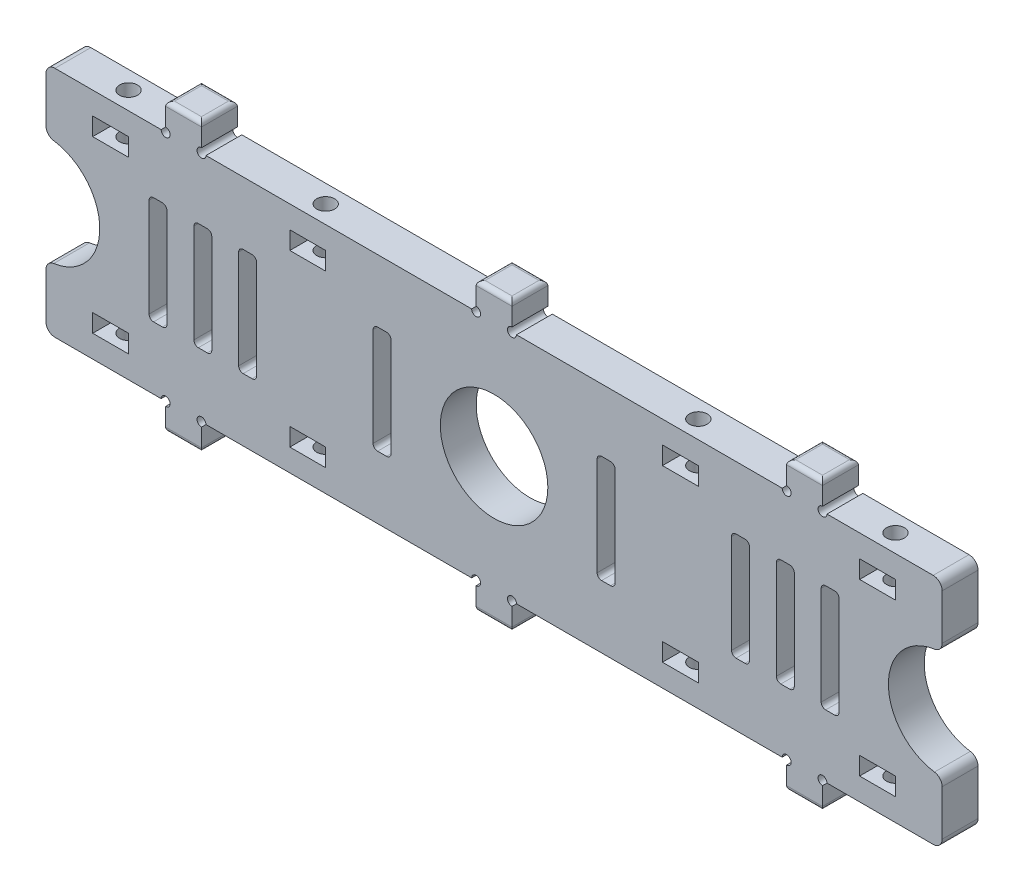
from build123d import *

# Parameters (mm, degrees)
SKETCH1_W           = 4
SKETCH1_H           = 2
BOSS_EXTRUDE3_DEPTH = 4
FILLET1_R           = 0.5
FILLET2_R           = 1
FILLET3_R           = 0.5
SKETCH3_R           = 1
CUT_EXTRUDE1_DEPTH  = 10


with BuildPart() as part:
    # Sketch1 → Boss-Extrude3 (new body)
    with BuildSketch(Plane.XY):
        with BuildLine():
            ThreePointArc((2.636402901, -4.272408368), (3.489956292, -3.918854978), (3.136402901, -4.772408368))
            Line((3.136402901, -4.772408368), (3.136402901, -7.272408368))
            Line((3.136402901, -7.272408368), (7.136402901, -7.272408368))
            Line((7.136402901, -7.272408368), (7.136402901, -4.772408368))
            ThreePointArc((7.136402901, -4.772408368), (6.782849511, -3.918854978), (7.636402901, -4.272408368))
            Line((7.636402901, -4.272408368), (37.286402901, -4.272408368))
            ThreePointArc((37.286402901, -4.272408368), (38.139956292, -3.918854978), (37.786402901, -4.772408368))
            Line((37.786402901, -4.772408368), (37.786402901, -7.272408368))
            Line((37.786402901, -7.272408368), (39.786402901, -7.272408368))
            Line((39.786402901, -7.272408368), (39.786402901, 2.727591632))
            ThreePointArc((39.786402901, 2.727591632), (35.543762214, 4.484950945), (33.786402901, 8.727591632))
            Line((33.786402901, 8.727591632), (28.286402901, 8.727591632))
            Line((28.286402901, 8.727591632), (28.286402901, 2.727591632))
            Line((28.286402901, 2.727591632), (26.286402901, 2.727591632))
            Line((26.286402901, 2.727591632), (26.286402901, 8.727591632))
            Line((26.286402901, 8.727591632), (13.286402901, 8.727591632))
            Line((13.286402901, 8.727591632), (13.286402901, 2.727591632))
            Line((13.286402901, 2.727591632), (11.286402901, 2.727591632))
            Line((11.286402901, 2.727591632), (11.286402901, 8.727591632))
            Line((11.286402901, 8.727591632), (8.286402901, 8.727591632))
            Line((8.286402901, 8.727591632), (8.286402901, 2.727591632))
            Line((8.286402901, 2.727591632), (6.286402901, 2.727591632))
            Line((6.286402901, 2.727591632), (6.286402901, 8.727591632))
            Line((6.286402901, 8.727591632), (3.286402901, 8.727591632))
            Line((3.286402901, 8.727591632), (3.286402901, 2.727591632))
            Line((3.286402901, 2.727591632), (1.286402901, 2.727591632))
            Line((1.286402901, 2.727591632), (1.286402901, 8.727591632))
            Line((1.286402901, 8.727591632), (-4.213597099, 8.727591632))
            ThreePointArc((-4.213597099, 8.727591632), (-5.970956412, 4.484950945), (-10.213597099, 2.727591632))
            Line((-10.213597099, 2.727591632), (-10.213597099, -4.272408368))
            Line((-10.213597099, -4.272408368), (2.636402901, -4.272408368))
        make_face()
        with Locations((-3.003597099, -0.772408368)):
            Rectangle(SKETCH1_W, SKETCH1_H, mode=Mode.SUBTRACT)
        with Locations((18.996402901, -0.772408368)):
            Rectangle(SKETCH1_W, SKETCH1_H, mode=Mode.SUBTRACT)
    extrude(amount=BOSS_EXTRUDE3_DEPTH)

    # Fillet1
    fillet1_edges = [part.edges().sort_by_distance(p)[0] for p in [
        (1.286402901, 2.727591632, 2),
        (3.286402901, 2.727591632, 2),
        (6.286402901, 2.727591632, 2),
        (8.286402901, 2.727591632, 2),
        (11.286402901, 2.727591632, 2),
        (13.286402901, 2.727591632, 2),
        (26.286402901, 2.727591632, 2),
        (28.286402901, 2.727591632, 2),
    ]]
    fillet(fillet1_edges, radius=FILLET1_R)

    # Fillet2
    fillet2_edges = [part.edges().sort_by_distance(p)[0] for p in [
        (-10.213597099, -4.272408368, 2),
        (-10.213597099, 2.727591632, 2),
    ]]
    fillet(fillet2_edges, radius=FILLET2_R)

    # Fillet3
    fillet3_edges = [part.edges().sort_by_distance(p)[0] for p in [
        (5.136402901, -7.272408368, 4),
        (38.786402901, -7.272408368, 4),
        (38.786402901, -7.272408368, 0),
        (5.136402901, -7.272408368, 0),
        (37.786402901, -7.272408368, 2),
        (7.136402901, -7.272408368, 2),
        (3.136402901, -7.272408368, 2),
    ]]
    fillet(fillet3_edges, radius=FILLET3_R)

    # Sketch3 → Cut-Extrude1 (cut)
    with BuildSketch(Plane.XZ.offset(4.272408368)):
        with Locations((18.996402901, 2)):
            Circle(SKETCH3_R)
        with Locations((-3.003597099, 2)):
            Circle(SKETCH3_R)
    extrude(amount=-CUT_EXTRUDE1_DEPTH, mode=Mode.SUBTRACT)

    # Mirror3: part across face


with BuildPart() as part_1:
    add(part.part)
    add(part.part.mirror(Plane(origin=(39.786402901, -2.259260078, 2), x_dir=(0, 0, 1), z_dir=(1, 0, 0))))

    # Mirror4: part across plane


with BuildPart() as part_2:
    add(part_1.part)
    add(part_1.part.mirror(Plane(origin=(0, 8.727591632, 4), x_dir=(0, 0, 1), z_dir=(0, 1, 0))))


solid = part_2.part
